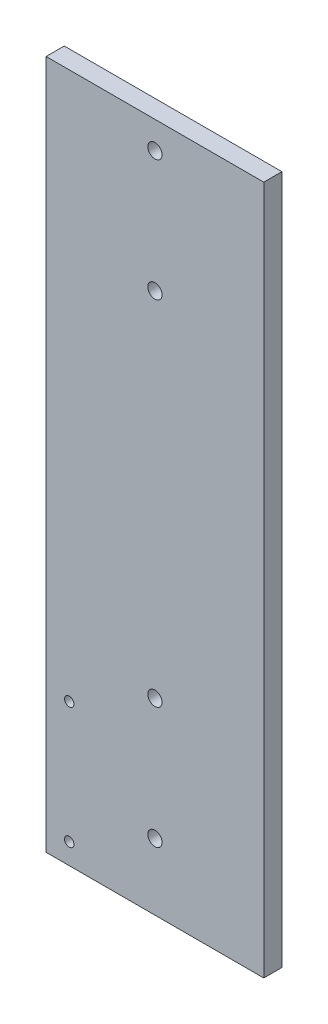
from build123d import *

# Parameters (mm, degrees)
SKETCH1_W           = 76.2
SKETCH1_H           = 241.3
BOSS_EXTRUDE1_DEPTH = 6.35
M6_TAPPED_HOLE1_D   = 5
M4_TAPPED_HOLE1_D   = 3.3


with BuildPart() as part:
    # Sketch1 → Boss-Extrude1 (new body)
    with BuildSketch(Plane.XY):
        Rectangle(SKETCH1_W, SKETCH1_H)
    extrude(amount=BOSS_EXTRUDE1_DEPTH)

    # M6 Tapped Hole1 (through all)
    with Locations(Plane.XY.offset(6.35)):
        with Locations((0, -97.375), (0, 111.125), (0, -54.875), (0, 68.625)):
            Hole(M6_TAPPED_HOLE1_D / 2)

    # M4 Tapped Hole1 (through all)
    with Locations(Plane.XY.offset(6.35)):
        with Locations((-30, -70.875), (-30, -113.375)):
            Hole(M4_TAPPED_HOLE1_D / 2)


solid = part.part
